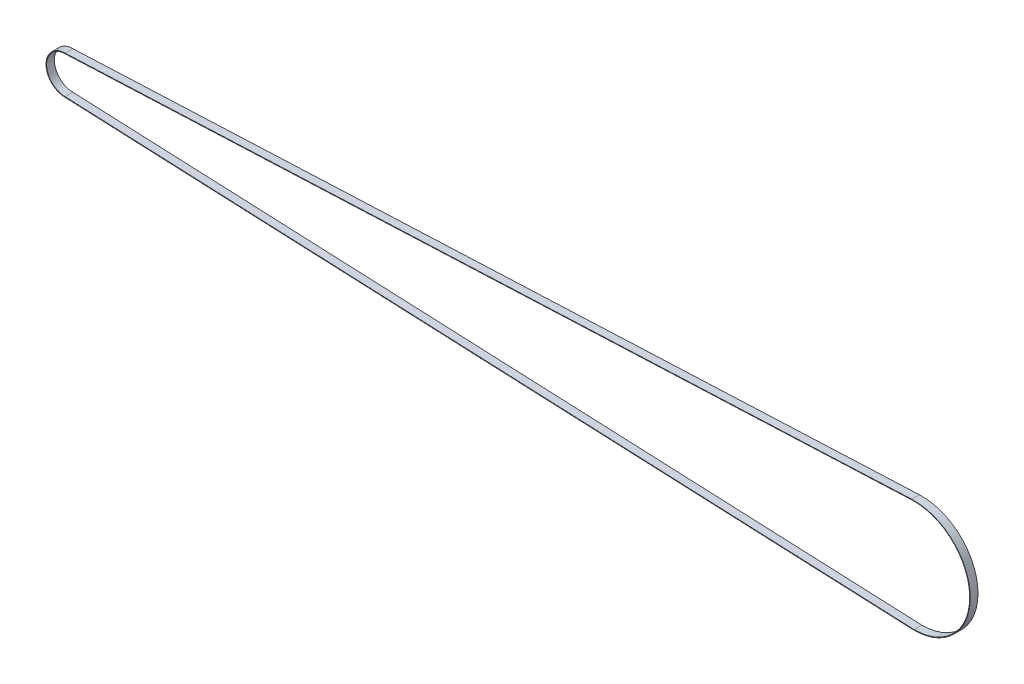
from build123d import *

# Parameters (mm, degrees)
BOSS_EXTRUDE1_DEPTH = 12.7


with BuildPart() as part:
    # Sketch1 → Boss-Extrude1 (new body)
    with BuildSketch(Plane.XY):
        with BuildLine():
            Line((-1396.238, 31.496967894), (-4.029007562, 92.281060706))
            ThreePointArc((-4.029007562, 92.281060706), (92.368972425, 0), (-4.029007562, -92.281060706))
            Line((-4.029007562, -92.281060706), (-1396.238, -31.496967894))
            ThreePointArc((-1396.238, -31.496967894), (-1427.734967894, 0), (-1396.238, 31.496967894))
        make_face()
        with BuildLine():
            Line((-3.994191963, 91.35272317), (-1396.238, 30.48))
            ThreePointArc((-1396.238, 30.48), (-1426.718, 0), (-1396.238, -30.48))
            Line((-1396.238, -30.48), (0, -91.44))
            ThreePointArc((0, -91.44), (91.418178189, 1.997572695), (-3.994191963, 91.35272317))
        make_face(mode=Mode.SUBTRACT)
    extrude(amount=BOSS_EXTRUDE1_DEPTH)


solid = part.part
